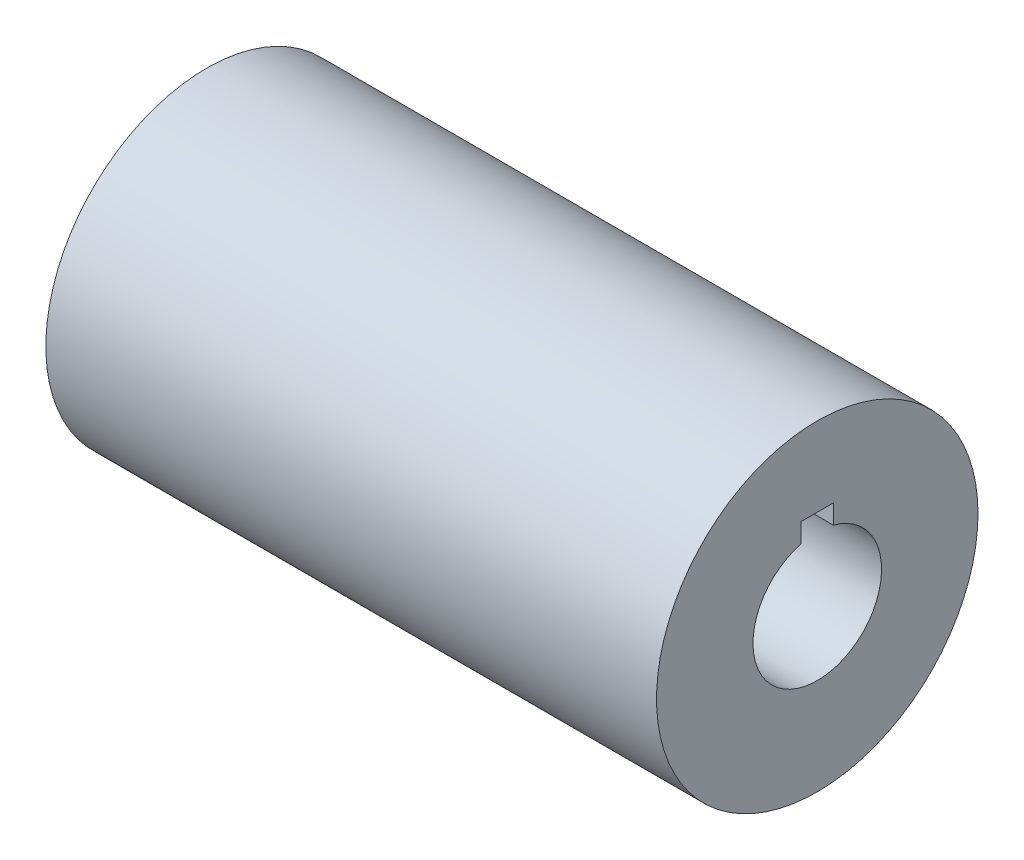
from build123d import *

# Parameters (mm, degrees)
SKETCH1_R           = 10
BOSS_EXTRUDE2_DEPTH = 38
SKETCH9_R           = 4
CUT_EXTRUDE5_DEPTH  = 38
SKETCH10_R          = 4.5
CUT_EXTRUDE6_DEPTH  = 18
SKETCH11_W          = 3
SKETCH11_H          = 1.6
CUT_EXTRUDE7_DEPTH  = 18
SKETCH12_W          = 2
SKETCH12_H          = 1.2
CUT_EXTRUDE8_DEPTH  = 20


with BuildPart() as part:
    # Sketch1 → Boss-Extrude2 (new body)
    with BuildSketch(Plane(origin=(0, 0, 0), x_dir=(0, 0, -1), z_dir=(1, 0, 0))):
        Circle(SKETCH1_R)
    extrude(amount=BOSS_EXTRUDE2_DEPTH)

    # Sketch9 → Cut-Extrude5 (cut)
    with BuildSketch(Plane(origin=(38, 0, 0), x_dir=(0, 0, -1), z_dir=(1, 0, 0))):
        Circle(SKETCH9_R)
    extrude(amount=-CUT_EXTRUDE5_DEPTH, mode=Mode.SUBTRACT)

    # Sketch10 → Cut-Extrude6 (cut)
    with BuildSketch(Plane.ZY):
        Circle(SKETCH10_R)
    extrude(amount=-CUT_EXTRUDE6_DEPTH, mode=Mode.SUBTRACT)

    # Sketch11 → Cut-Extrude7 (cut)
    with BuildSketch(Plane.ZY):
        with Locations((0, 5.042640687)):
            Rectangle(SKETCH11_W, SKETCH11_H)
    extrude(amount=-CUT_EXTRUDE7_DEPTH, mode=Mode.SUBTRACT)

    # Sketch12 → Cut-Extrude8 (cut)
    with BuildSketch(Plane(origin=(38, 0, 0), x_dir=(0, 0, -1), z_dir=(1, 0, 0))):
        with Locations((0, 4.472983346)):
            Rectangle(SKETCH12_W, SKETCH12_H)
    extrude(amount=-CUT_EXTRUDE8_DEPTH, mode=Mode.SUBTRACT)


solid = part.part
